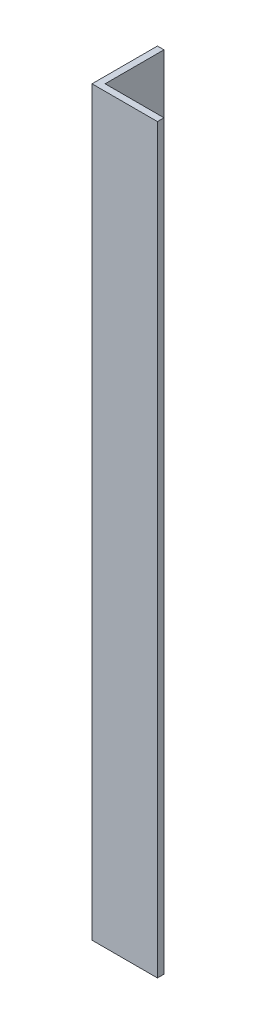
from build123d import *

# Parameters (mm, degrees)
BOSS_EXTRUDE1_DEPTH = 340


with BuildPart() as part:
    # Sketch1 → Boss-Extrude1 (new body)
    with BuildSketch(Plane(origin=(0, 0, 0), x_dir=(1, 0, 0), z_dir=(0, 1, 0))):
        Polygon((0, 0), (30, 0), (30, 3), (3, 3), (3, 30), (0, 30), align=None)
    extrude(amount=BOSS_EXTRUDE1_DEPTH)


solid = part.part
